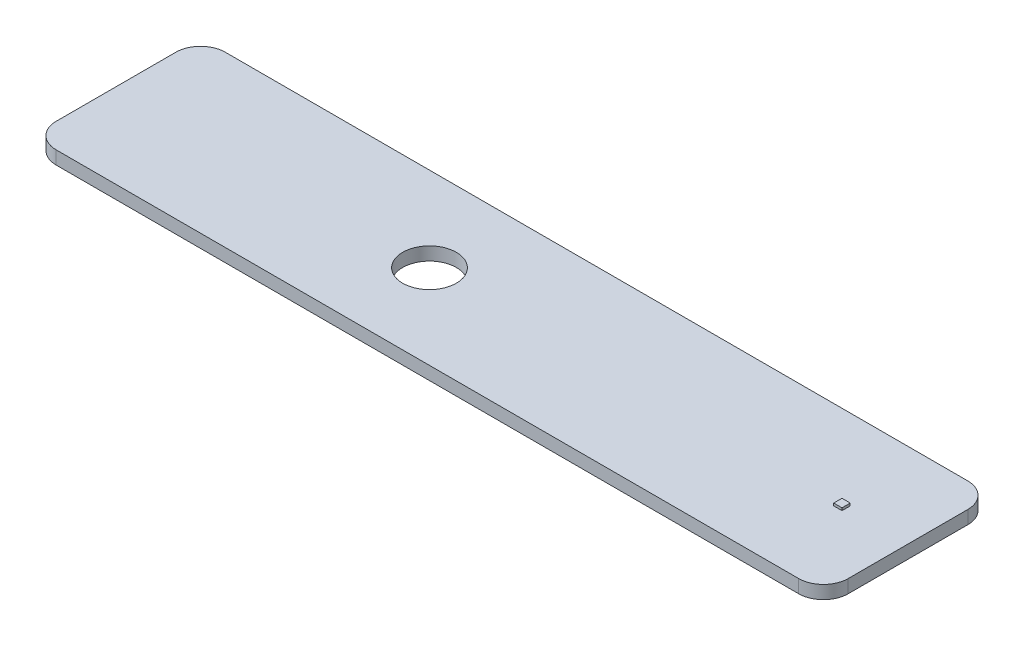
from build123d import *

# Parameters (mm, degrees)
BOSS_EXTRUDE1_DEPTH = 1.6
SKETCH2_W           = 1
SKETCH2_H           = 1
BOSS_EXTRUDE2_DEPTH = 0.3
SKETCH3_R           = 3.25
CUT_EXTRUDE1_DEPTH  = 50.108273234


with BuildPart() as part:
    # Sketch1 → Boss-Extrude1 (new body)
    with BuildSketch(Plane(origin=(0, 0, 0), x_dir=(1, 0, 0), z_dir=(0, 1, 0))):
        with BuildLine():
            Line((-45, 10.25), (45, 10.25))
            ThreePointArc((45, 10.25), (47.121320344, 9.371320344), (48, 7.25))
            Line((48, 7.25), (48, -7.25))
            ThreePointArc((48, -7.25), (47.121320344, -9.371320344), (45, -10.25))
            Line((45, -10.25), (-45, -10.25))
            ThreePointArc((-45, -10.25), (-47.121320344, -9.371320344), (-48, -7.25))
            Line((-48, -7.25), (-48, 7.25))
            ThreePointArc((-48, 7.25), (-47.121320344, 9.371320344), (-45, 10.25))
        make_face()
    extrude(amount=BOSS_EXTRUDE1_DEPTH)

    # Sketch2 → Boss-Extrude2 (add)
    with BuildSketch(Plane(origin=(0, 1.6, 0), x_dir=(1, 0, 0), z_dir=(0, 1, 0))):
        with Locations((40, 0)):
            Rectangle(SKETCH2_W, SKETCH2_H)
    extrude(amount=BOSS_EXTRUDE2_DEPTH)

    # Sketch3 → Cut-Extrude1 (cut, through all)
    with BuildSketch(Plane(origin=(0, 1.6, 0), x_dir=(1, 0, 0), z_dir=(0, 1, 0))):
        with Locations(Location((-10, 0, 0), (0, 0, 270))):
            Circle(SKETCH3_R)
    extrude(amount=-CUT_EXTRUDE1_DEPTH, mode=Mode.SUBTRACT)


solid = part.part
